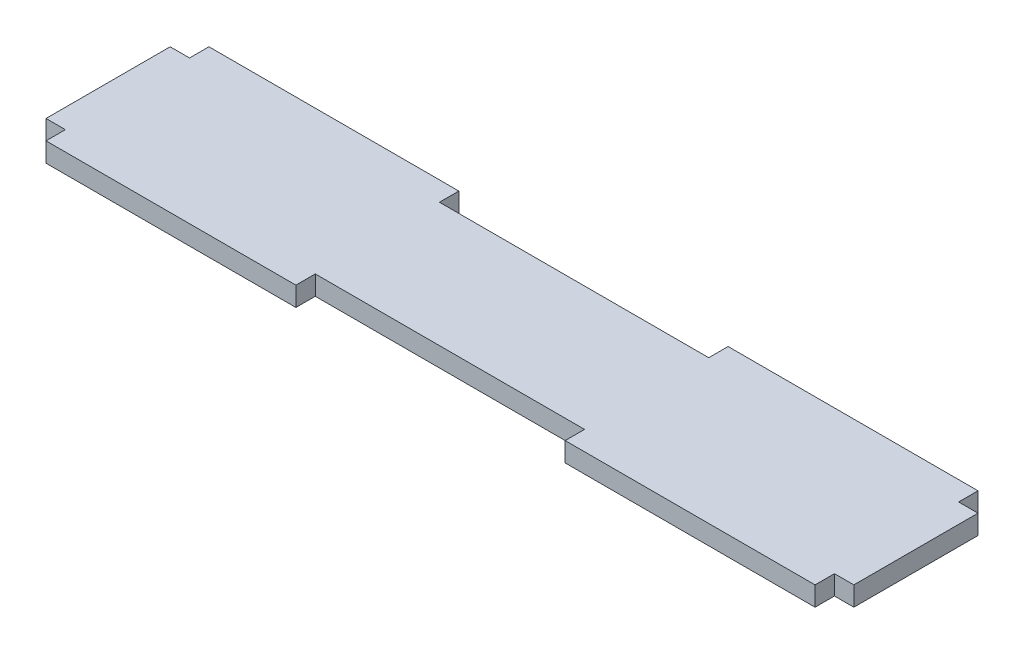
from build123d import *

# Parameters (mm, degrees)
SKETCH2_W           = 500
SKETCH2_H           = 100.85
BOSS_EXTRUDE1_DEPTH = 12
SKETCH4_W           = 12
SKETCH4_H           = 12
CUT_EXTRUDE2_DEPTH  = 511.210468826
SKETCH5_W           = 166.666666666
SKETCH5_H           = 12
CUT_EXTRUDE3_DEPTH  = 511.210468826
SCALE1_SCALE        = 0.5


with BuildPart() as part:
    # Sketch2 → Boss-Extrude1 (new body)
    with BuildSketch(Plane(origin=(0, 0, 0), x_dir=(1, 0, 0), z_dir=(0, 1, 0))):
        with Locations((250, 50.425)):
            Rectangle(SKETCH2_W, SKETCH2_H)
    extrude(amount=BOSS_EXTRUDE1_DEPTH)

    # Sketch4 → Cut-Extrude2 (cut, through all)
    with BuildSketch(Plane(origin=(0, 12, 0), x_dir=(1, 0, 0), z_dir=(0, 1, 0))):
        with Locations((494, 6)):
            Rectangle(SKETCH4_W, SKETCH4_H)
        with Locations((494, 94.85)):
            Rectangle(SKETCH4_W, SKETCH4_H)
        with Locations((6, 94.85)):
            Rectangle(SKETCH4_W, SKETCH4_H)
        with Locations((6, 6)):
            Rectangle(SKETCH4_W, SKETCH4_H)
    extrude(amount=-CUT_EXTRUDE2_DEPTH, mode=Mode.SUBTRACT)

    # Sketch5 → Cut-Extrude3 (cut, through all)
    with BuildSketch(Plane(origin=(0, 12, 0), x_dir=(1, 0, 0), z_dir=(0, 1, 0))):
        with Locations((250, 94.85)):
            Rectangle(SKETCH5_W, SKETCH5_H)
        with Locations((250, 6)):
            Rectangle(SKETCH5_W, SKETCH5_H)
    extrude(amount=-CUT_EXTRUDE3_DEPTH, mode=Mode.SUBTRACT)


with BuildPart() as part_1:
    # Scale1: scaled about (250, 6, -50.425)
    add(part.part.scale(SCALE1_SCALE).moved(Location((125, 3, -25.2125))))


solid = part_1.part
